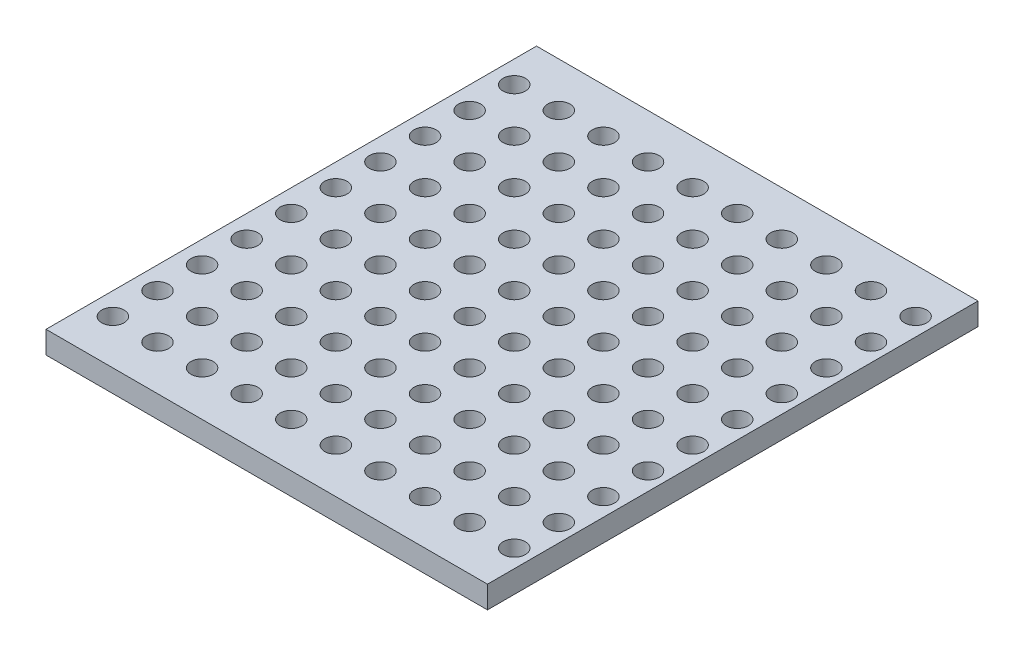
from build123d import *

# Parameters (mm, degrees)
CROQUIS1_W                        = 19.8
CROQUIS1_H                        = 22
SALIENTE_EXTRUIR1_DEPTH           = 1
DI_METRO_DE_TALADRO_1_0_1_1_D     = 1
DI_METRO_DE_TALADRO_1_0_1_1_DEPTH = 12
DI_METRO_DE_TALADRO_1_0_1_1_TIP   = 0.30043031


with BuildPart() as part:
    # Croquis1 → Saliente-Extruir1 (new body)
    with BuildSketch(Plane(origin=(0, 0, 0), x_dir=(1, 0, 0), z_dir=(0, 1, 0))):
        Rectangle(CROQUIS1_W, CROQUIS1_H)
    extrude(amount=SALIENTE_EXTRUIR1_DEPTH)

    # Diámetro de taladro Ø1.0 (1)1
    with Locations(Plane(origin=(-8.9, 1, -9), x_dir=(0, 0, 1), z_dir=(0, 1, 0))):
        with Locations((0, 0), (0, 2), (0, 4), (0, 6), (0, 8), (0, 10), (0, 12), (0, 14), (0, 16), (0, 18), (2, 0), (2, 2), (2, 4), (2, 6), (2, 8), (2, 10), (2, 12), (2, 14), (2, 16), (2, 18), (4, 18), (4, 16), (4, 14), (4, 12), (4, 10), (4, 8), (4, 6), (4, 4), (4, 2), (4, 0), (6, 0), (6, 2), (6, 4), (6, 6), (6, 8), (6, 10), (6, 12), (6, 14), (6, 16), (6, 18), (8, 18), (8, 16), (8, 14), (8, 12), (8, 10), (8, 8), (8, 6), (8, 4), (8, 2), (8, 0), (10, 0), (10, 2), (10, 4), (10, 6), (10, 8), (10, 10), (10, 12), (10, 14), (10, 16), (10, 18), (12, 18), (12, 16), (12, 14), (12, 12), (12, 10), (12, 8), (12, 6), (12, 4), (12, 2), (12, 0), (14, 0), (14, 2), (14, 4), (14, 6), (14, 8), (14, 10), (14, 12), (14, 14), (14, 16), (14, 18), (16, 18), (16, 16), (16, 14), (16, 12), (16, 10), (16, 8), (16, 6), (16, 4), (16, 2), (16, 0), (18, 0), (18, 2), (18, 4), (18, 6), (18, 8), (18, 10), (18, 12), (18, 14), (18, 16), (18, 18)):
            Hole(DI_METRO_DE_TALADRO_1_0_1_1_D / 2, depth=DI_METRO_DE_TALADRO_1_0_1_1_DEPTH)
            with Locations((0, 0, -(DI_METRO_DE_TALADRO_1_0_1_1_DEPTH + DI_METRO_DE_TALADRO_1_0_1_1_TIP / 2))):  # 118° drill point
                Cone(0, DI_METRO_DE_TALADRO_1_0_1_1_D / 2, DI_METRO_DE_TALADRO_1_0_1_1_TIP, mode=Mode.SUBTRACT)


solid = part.part
